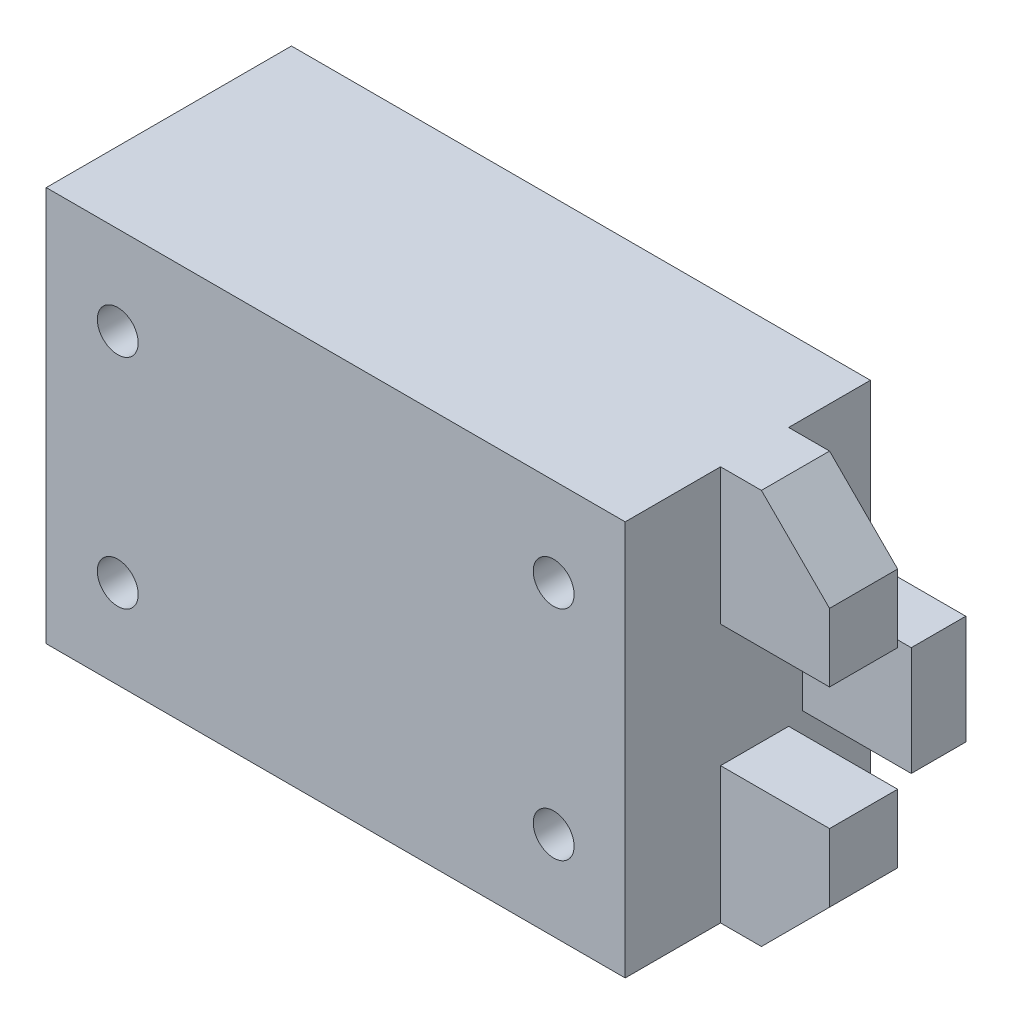
from build123d import *

# Parameters (mm, degrees)
SKETCH_1_W          = 85
SKETCH_1_H          = 58
SKETCH_1_R          = 1.75
EXTRUDE_1_DEPTH     = 36
SKETCH_2_R          = 3
CUT_EXTRUDE_1_DEPTH = 31
SKETCH_5_W          = 8
SKETCH_5_H          = 16
EXTRUDE_867_DEPTH   = 16
SKETCH_6_W          = 10
SKETCH_6_H          = 20
EXTRUDE_2_DEPTH     = 16
CHAMFER_1_SIZE      = 10


with BuildPart() as part:
    # 草图1 → 凸台-拉伸1 (new body)
    with BuildSketch(Plane.XY):
        with Locations((42.5, 29)):
            Rectangle(SKETCH_1_W, SKETCH_1_H)
        with Locations((10.5, 45)):
            Circle(SKETCH_1_R, mode=Mode.SUBTRACT)
        with Locations((74.5, 45)):
            Circle(SKETCH_1_R, mode=Mode.SUBTRACT)
        with Locations((10.5, 13)):
            Circle(SKETCH_1_R, mode=Mode.SUBTRACT)
        with Locations((74.5, 13)):
            Circle(SKETCH_1_R, mode=Mode.SUBTRACT)
    extrude(amount=EXTRUDE_1_DEPTH)

    # 草图2 → 切除-拉伸1 (cut)
    with BuildSketch(Plane.XY.offset(36)):
        with Locations((10.5, 45)):
            Circle(SKETCH_2_R)
        with Locations((74.5, 45)):
            Circle(SKETCH_2_R)
        with Locations((74.5, 13)):
            Circle(SKETCH_2_R)
        with Locations((10.5, 13)):
            Circle(SKETCH_2_R)
    extrude(amount=-CUT_EXTRUDE_1_DEPTH, mode=Mode.SUBTRACT)

    # 草图5 → Extrude 867 (add)
    with BuildSketch(Plane(origin=(85, 0, 0), x_dir=(0, 0, -1), z_dir=(1, 0, 0))):
        with Locations((-6, 29)):
            Rectangle(SKETCH_5_W, SKETCH_5_H)
    extrude(amount=EXTRUDE_867_DEPTH)

    # 草图6 → 凸台-拉伸2 (add)
    with BuildSketch(Plane(origin=(85, 0, 0), x_dir=(0, 0, -1), z_dir=(1, 0, 0))):
        with Locations((-17, 48)):
            Rectangle(SKETCH_6_W, SKETCH_6_H)
        with Locations((-17, 10)):
            Rectangle(SKETCH_6_W, SKETCH_6_H)
    extrude(amount=EXTRUDE_2_DEPTH)

    # 倒角1
    chamfer_1_edges = [part.edges().sort_by_distance(p)[0] for p in [
        (101, 58, 17),
        (101, 0, 17),
    ]]
    chamfer(chamfer_1_edges, length=CHAMFER_1_SIZE)


solid = part.part
